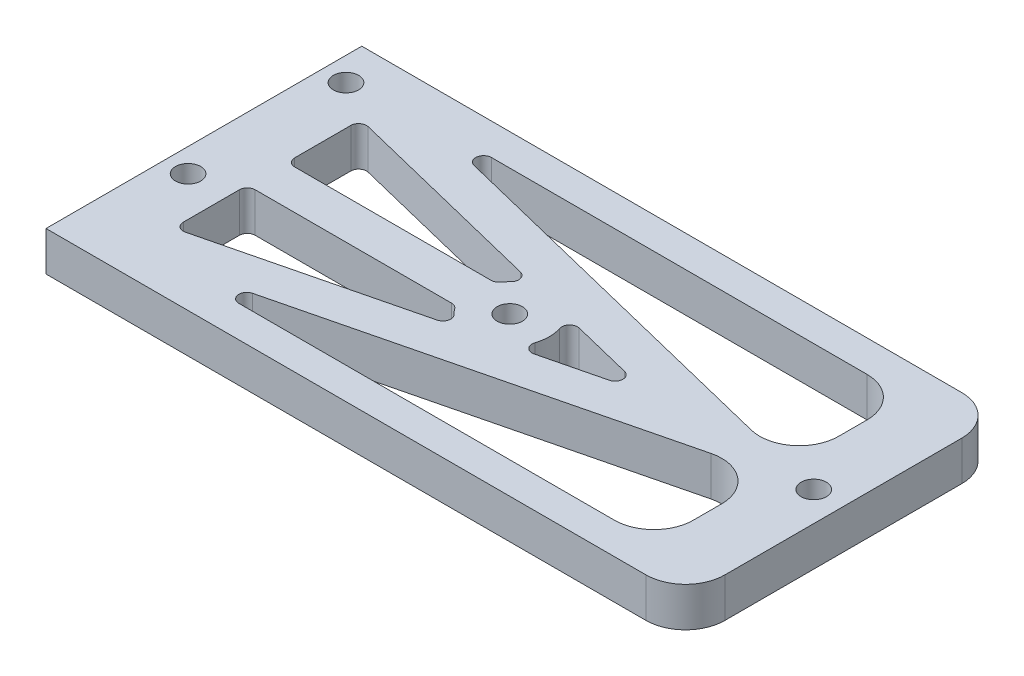
from build123d import *

# Parameters (mm, degrees)
SKETCH_1_W          = 81
SKETCH_1_H          = 40
EXTRUDE_1_DEPTH     = 5
SKETCH_2_R          = 1.6
CUT_EXTRUDE_1_DEPTH = 46.44502173
FILLET_1_R          = 5
SKETCH_3_R          = 1.6
CUT_EXTRUDE_2_DEPTH = 46.44502173
CUT_EXTRUDE_5_DEPTH = 10
FILLET_2_R          = 5
FILLET_3_R          = 5
FILLET_4_R          = 1
FILLET_5_R          = 1


with BuildPart() as part:
    # 草图1 → 凸台-拉伸1 (new body)
    with BuildSketch(Plane(origin=(0, 0, 0), x_dir=(1, 0, 0), z_dir=(0, 1, 0))):
        Rectangle(SKETCH_1_W, SKETCH_1_H)
    extrude(amount=EXTRUDE_1_DEPTH)

    # 草图2 → 切除-拉伸1 (cut, through all)
    with BuildSketch(Plane.XZ):
        with Locations(Location((36.75, 0, 0), (0, 0, 270))):
            Circle(SKETCH_2_R)
        with Locations(Location((-1.75, 0, 0), (0, 0, 270))):
            Circle(SKETCH_2_R)
    extrude(amount=-CUT_EXTRUDE_1_DEPTH, mode=Mode.SUBTRACT)

    # 圆角1
    fillet_1_edges = [part.edges().sort_by_distance(p)[0] for p in [
        (40.5, 2.5, 20),
        (40.5, 2.5, -20),
    ]]
    fillet(fillet_1_edges, radius=FILLET_1_R)

    # 草图3 → 切除-拉伸2 (cut, through all)
    with BuildSketch(Plane.XZ):
        with Locations(Location((-37.5, 5, 0), (0, 0, 270))):
            Circle(SKETCH_3_R)
        with Locations(Location((-37.5, -15, 0), (0, 0, 270))):
            Circle(SKETCH_3_R)
    extrude(amount=-CUT_EXTRUDE_2_DEPTH, mode=Mode.SUBTRACT)

    # 草图4 → 切除-拉伸5 (cut)
    with BuildSketch(Plane.XZ):
        Polygon((32.5, 16), (-28.316233007, 16), (32.5, 1.029850337), align=None)
        with BuildLine():
            Line((-3.40399678, 4.718505553), (-32.5, 11.880598653))
            Line((-32.5, 11.880598653), (-32.5, 2.5))
            Line((-32.5, 2.5), (-6.080127019, 2.5))
            ThreePointArc((-6.080127019, 2.5), (-4.941061913, 3.849301738), (-3.40399678, 4.718505553))
        make_face()
        Polygon((32.5, -1.029850337), (-28.316233007, -16), (32.5, -16), align=None)
        with BuildLine():
            Line((15.764932029, 0), (1.905256588, 3.411612416))
            ThreePointArc((1.905256588, 3.411612416), (3.25, 0), (1.905256588, -3.411612416))
            Line((1.905256588, -3.411612416), (15.764932029, 0))
        make_face()
        with BuildLine():
            Line((-32.5, -2.5), (-32.5, -11.880598653))
            Line((-32.5, -11.880598653), (-3.40399678, -4.718505553))
            ThreePointArc((-3.40399678, -4.718505553), (-4.941061913, -3.849301738), (-6.080127019, -2.5))
            Line((-6.080127019, -2.5), (-32.5, -2.5))
        make_face()
    extrude(amount=-CUT_EXTRUDE_5_DEPTH, mode=Mode.SUBTRACT)

    # 圆角2
    fillet_2_edges = [part.edges().sort_by_distance(p)[0] for p in [
        (32.5, 2.5, 1.029850337),
        (32.5, 2.5, -1.029850337),
    ]]
    fillet(fillet_2_edges, radius=FILLET_2_R)

    # 圆角3
    fillet_3_edges = [part.edges().sort_by_distance(p)[0] for p in [
        (32.5, 2.5, 16),
        (32.5, 2.5, -16),
    ]]
    fillet(fillet_3_edges, radius=FILLET_3_R)

    # 圆角4
    fillet_4_edges = [part.edges().sort_by_distance(p)[0] for p in [
        (1.905256588, 2.5, -3.411612416),
        (1.905256588, 2.5, 3.411612416),
        (15.764932029, 2.5, 0),
    ]]
    fillet(fillet_4_edges, radius=FILLET_4_R)

    # 圆角5
    fillet_5_edges = [part.edges().sort_by_distance(p)[0] for p in [
        (-6.080127019, 2.5, -2.5),
        (-3.40399678, 2.5, -4.718505553),
        (-32.5, 2.5, -11.880598653),
        (-32.5, 2.5, -2.5),
        (-28.316233007, 2.5, 16),
        (-28.316233007, 2.5, -16),
        (-3.40399678, 2.5, 4.718505553),
        (-6.080127019, 2.5, 2.5),
        (-32.5, 2.5, 2.5),
        (-32.5, 2.5, 11.880598653),
    ]]
    fillet(fillet_5_edges, radius=FILLET_5_R)


solid = part.part
